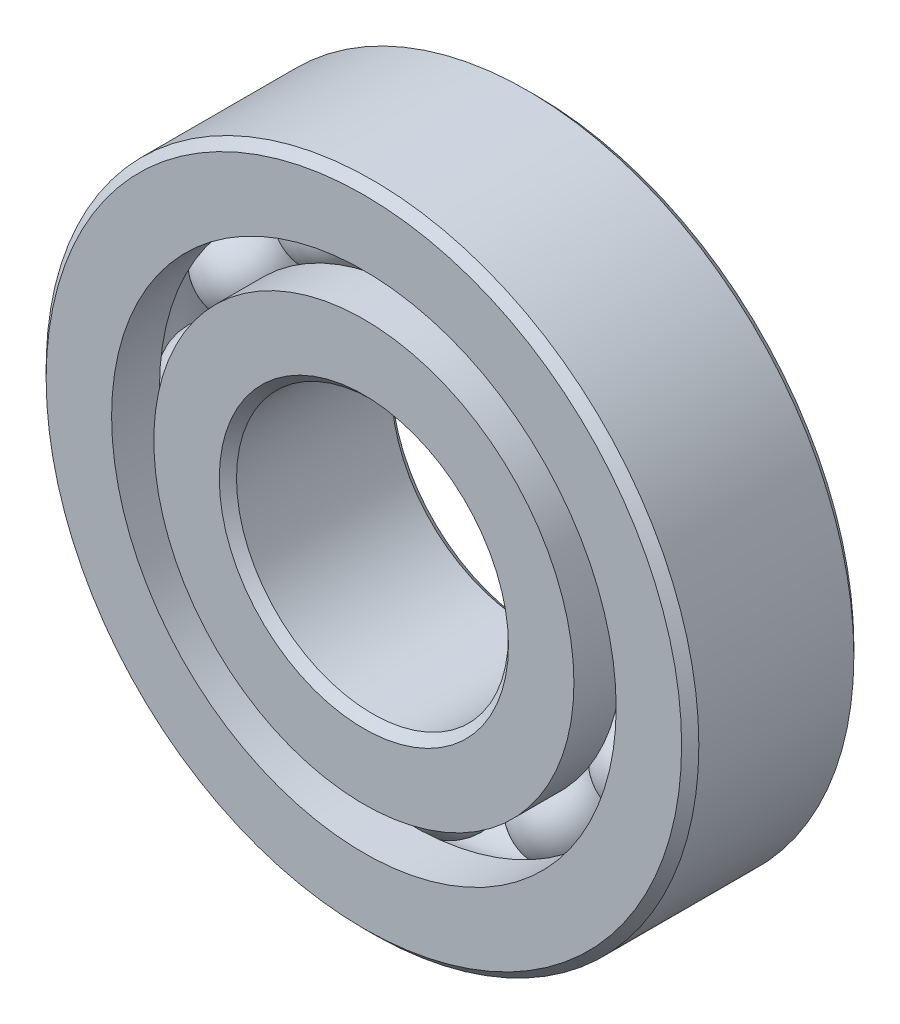
from build123d import *

# Parameters (mm, degrees)
CIRPATTERN1_COUNT = 12


with BuildPart() as part:
    # Sketch1 → Revolve1 (revolve)
    with BuildSketch(Plane(origin=(0, 0, 0), x_dir=(0, 0, -1), z_dir=(1, 0, 0))):
        with BuildLine():
            Line((8.55, 36), (-8.55, 36))
            Line((-8.55, 36), (-9.5, 35.05))
            Line((-9.5, 35.05), (-9.5, 27.82967033))
            Line((-9.5, 27.82967033), (-4.222222222, 27.82967033))
            ThreePointArc((-4.222222222, 27.82967033), (0, 30.32229451), (4.222222222, 27.82967033))
            Line((4.222222222, 27.82967033), (9.5, 27.82967033))
            Line((9.5, 27.82967033), (9.5, 35.05))
            Line((9.5, 35.05), (8.55, 36))
        make_face()
    revolve(axis=Axis((0, 0, 9.5), (0, 0, -1)))


with BuildPart() as body_2:
    # Sketch3 → Revolve3 (revolve)
    with BuildSketch(Plane(origin=(0, 0, 0), x_dir=(0, 0, -1), z_dir=(1, 0, 0))):
        with BuildLine():
            Line((-9.5, 23.17032967), (-4.222222222, 23.17032967))
            ThreePointArc((-4.222222222, 23.17032967), (0, 20.67770549), (4.222222222, 23.17032967))
            Line((4.222222222, 23.17032967), (9.5, 23.17032967))
            Line((9.5, 23.17032967), (9.5, 15.95))
            Line((9.5, 15.95), (8.55, 15))
            Line((8.55, 15), (-8.55, 15))
            Line((-8.55, 15), (-9.5, 15.95))
            Line((-9.5, 15.95), (-9.5, 23.17032967))
        make_face()
    revolve(axis=Axis((0, 0, 9.5), (0, 0, -1)))


with BuildPart() as body_3:
    # Sketch4 → Revolve4 (revolve)
    with BuildSketch(Plane(origin=(0, 0, 0), x_dir=(0, 0, -1), z_dir=(1, 0, 0))):
        with BuildLine():
            Line((-4.82229451, 25.5), (4.82229451, 25.5))
            ThreePointArc((4.82229451, 25.5), (0, 30.32229451), (-4.82229451, 25.5))
        make_face()
    revolve(axis=Axis((0, 25.5, 4.82229451), (0, 0, -1)))


with BuildPart() as cirpattern1_1:
    # CirPattern1: pattern copy
    add(body_3.part.rotate(Axis((0, 0, -9.5), (0, 0, 1)), 1 * 360 / CIRPATTERN1_COUNT))


with BuildPart() as cirpattern1_2:
    # CirPattern1: pattern copy
    add(body_3.part.rotate(Axis((0, 0, -9.5), (0, 0, 1)), 2 * 360 / CIRPATTERN1_COUNT))


with BuildPart() as cirpattern1_3:
    # CirPattern1: pattern copy
    add(body_3.part.rotate(Axis((0, 0, -9.5), (0, 0, 1)), 3 * 360 / CIRPATTERN1_COUNT))


with BuildPart() as cirpattern1_4:
    # CirPattern1: pattern copy
    add(body_3.part.rotate(Axis((0, 0, -9.5), (0, 0, 1)), 4 * 360 / CIRPATTERN1_COUNT))


with BuildPart() as cirpattern1_5:
    # CirPattern1: pattern copy
    add(body_3.part.rotate(Axis((0, 0, -9.5), (0, 0, 1)), 5 * 360 / CIRPATTERN1_COUNT))


with BuildPart() as cirpattern1_6:
    # CirPattern1: pattern copy
    add(body_3.part.rotate(Axis((0, 0, -9.5), (0, 0, 1)), 6 * 360 / CIRPATTERN1_COUNT))


with BuildPart() as cirpattern1_7:
    # CirPattern1: pattern copy
    add(body_3.part.rotate(Axis((0, 0, -9.5), (0, 0, 1)), 7 * 360 / CIRPATTERN1_COUNT))


with BuildPart() as cirpattern1_8:
    # CirPattern1: pattern copy
    add(body_3.part.rotate(Axis((0, 0, -9.5), (0, 0, 1)), 8 * 360 / CIRPATTERN1_COUNT))


with BuildPart() as cirpattern1_9:
    # CirPattern1: pattern copy
    add(body_3.part.rotate(Axis((0, 0, -9.5), (0, 0, 1)), 9 * 360 / CIRPATTERN1_COUNT))


with BuildPart() as cirpattern1_10:
    # CirPattern1: pattern copy
    add(body_3.part.rotate(Axis((0, 0, -9.5), (0, 0, 1)), 10 * 360 / CIRPATTERN1_COUNT))


with BuildPart() as cirpattern1_11:
    # CirPattern1: pattern copy
    add(body_3.part.rotate(Axis((0, 0, -9.5), (0, 0, 1)), 11 * 360 / CIRPATTERN1_COUNT))


solid = Compound([part.part, body_2.part, body_3.part, cirpattern1_1.part, cirpattern1_2.part, cirpattern1_3.part, cirpattern1_4.part, cirpattern1_5.part, cirpattern1_6.part, cirpattern1_7.part, cirpattern1_8.part, cirpattern1_9.part, cirpattern1_10.part, cirpattern1_11.part])
